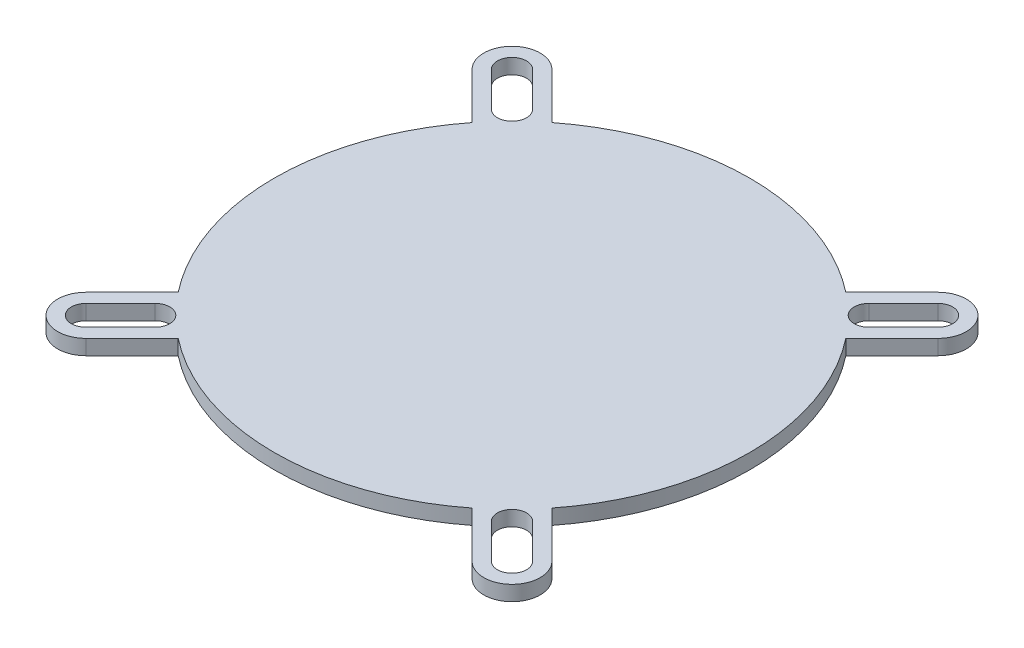
from build123d import *

# Parameters (mm, degrees)
SKETCH_1_R      = 25.25
EXTRUDE_1_DEPTH = 1.6
EXTRUDE_2_DEPTH = 1.6


with BuildPart() as part:
    # 草图1 → 凸台-拉伸1 (new body)
    with BuildSketch(Plane(origin=(0, 0, 0), x_dir=(1, 0, 0), z_dir=(0, 1, 0))):
        with Locations(Location((0, 0, 0), (0, 0, 270))):
            Circle(SKETCH_1_R)
    extrude(amount=EXTRUDE_1_DEPTH)

    # 草图2 → 凸台-拉伸2 (add)
    with BuildSketch(Plane(origin=(0, 1.6, 0), x_dir=(1, 0, 0), z_dir=(0, 1, 0))):
        with BuildLine():
            Line((-20.506096654, 24.748737342), (0, 4.242640687))
            Line((0, 4.242640687), (20.506096654, 24.748737342))
            ThreePointArc((20.506096654, 24.748737342), (24.748737342, 24.748737342), (24.748737342, 20.506096654))
            Line((24.748737342, 20.506096654), (4.242640687, 0))
            Line((4.242640687, 0), (24.748737342, -20.506096654))
            ThreePointArc((24.748737342, -20.506096654), (24.748737342, -24.748737342), (20.506096654, -24.748737342))
            Line((20.506096654, -24.748737342), (0, -4.242640687))
            Line((0, -4.242640687), (-20.506096654, -24.748737342))
            ThreePointArc((-20.506096654, -24.748737342), (-24.748737342, -24.748737342), (-24.748737342, -20.506096654))
            Line((-24.748737342, -20.506096654), (-4.242640687, 0))
            Line((-4.242640687, 0), (-24.748737342, 20.506096654))
            ThreePointArc((-24.748737342, 20.506096654), (-24.748737342, 24.748737342), (-20.506096654, 24.748737342))
        make_face()
        with BuildLine():
            Line((-21.531401487, 23.723432509), (-17.854446225, 20.046477247))
            ThreePointArc((-17.854446225, 20.046477247), (-17.854446225, 17.854446225), (-20.046477247, 17.854446225))
            Line((-20.046477247, 17.854446225), (-23.723432509, 21.531401487))
            ThreePointArc((-23.723432509, 21.531401487), (-23.723432509, 23.723432509), (-21.531401487, 23.723432509))
        make_face(mode=Mode.SUBTRACT)
        with BuildLine():
            Line((23.723432509, 21.531401487), (20.046477247, 17.854446225))
            ThreePointArc((20.046477247, 17.854446225), (17.854446225, 17.854446225), (17.854446225, 20.046477247))
            Line((17.854446225, 20.046477247), (21.531401487, 23.723432509))
            ThreePointArc((21.531401487, 23.723432509), (23.723432509, 23.723432509), (23.723432509, 21.531401487))
        make_face(mode=Mode.SUBTRACT)
        with BuildLine():
            Line((21.531401487, -23.723432509), (17.854446225, -20.046477247))
            ThreePointArc((17.854446225, -20.046477247), (17.854446225, -17.854446225), (20.046477247, -17.854446225))
            Line((20.046477247, -17.854446225), (23.723432509, -21.531401487))
            ThreePointArc((23.723432509, -21.531401487), (23.723432509, -23.723432509), (21.531401487, -23.723432509))
        make_face(mode=Mode.SUBTRACT)
        with BuildLine():
            Line((-23.723432509, -21.531401487), (-20.046477247, -17.854446225))
            ThreePointArc((-20.046477247, -17.854446225), (-17.854446225, -17.854446225), (-17.854446225, -20.046477247))
            Line((-17.854446225, -20.046477247), (-21.531401487, -23.723432509))
            ThreePointArc((-21.531401487, -23.723432509), (-23.723432509, -23.723432509), (-23.723432509, -21.531401487))
        make_face(mode=Mode.SUBTRACT)
    extrude(amount=-EXTRUDE_2_DEPTH)


solid = part.part
